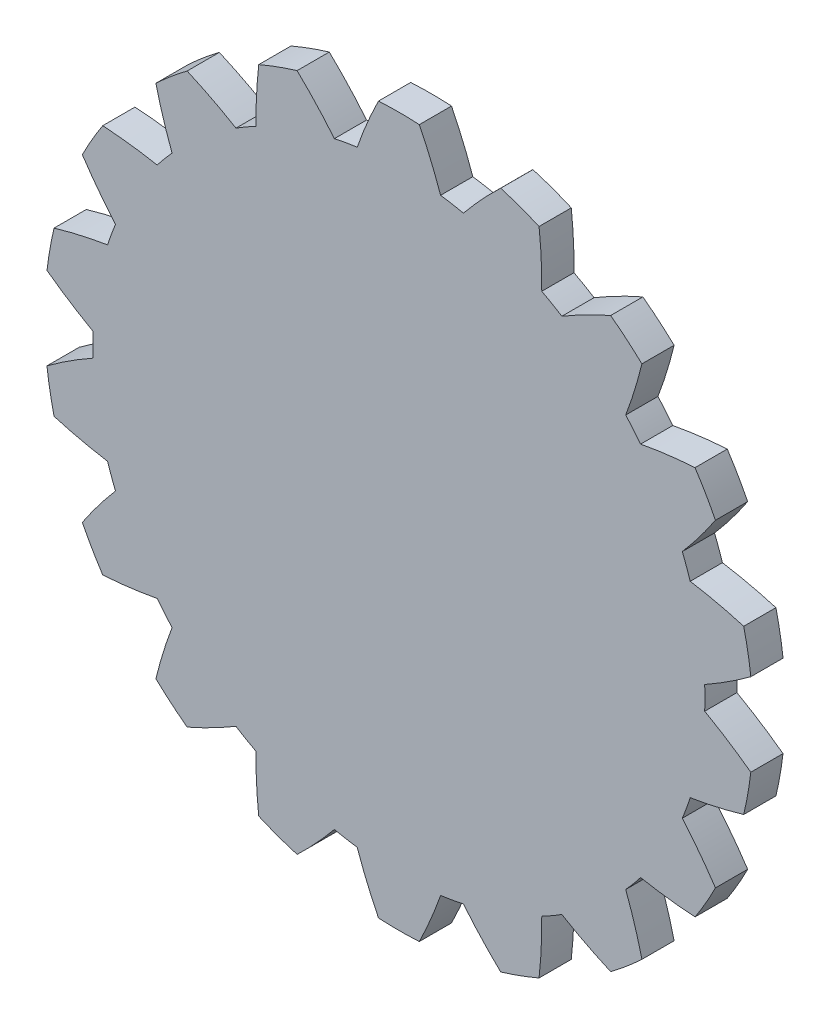
from build123d import *

# Parameters (mm, degrees)
SKETCH1_R           = 55.88
BOSS_EXTRUDE1_DEPTH = 5.08
CUT_EXTRUDE2_START  = -5.08
CUT_EXTRUDE2_DEPTH  = 5.08
CUT_EXTRUDE3_START  = -5.08
CUT_EXTRUDE3_DEPTH  = 5.08
CUT_EXTRUDE4_START  = -5.08
CUT_EXTRUDE4_DEPTH  = 5.08


with BuildPart() as part:
    # Sketch1 → Boss-Extrude1 (new body)
    with BuildSketch(Plane.XY):
        Circle(SKETCH1_R)
    extrude(amount=BOSS_EXTRUDE1_DEPTH)

    # Sketch2 → Cut-Extrude2 (cut)
    with BuildSketch(Plane.XY.offset(5.08).offset(CUT_EXTRUDE2_START)):
        with BuildLine():
            ThreePointArc((6.574796149, 47.810037185), (8.380261054, 47.52682216), (10.173708346, 47.175451863))
            ThreePointArc((10.173708346, 47.175451863), (13.016505162, 50.440575429), (16.055705426, 53.523721127))
            ThreePointArc((16.055705426, 53.523721127), (9.703460168, 55.031057238), (3.21876286, 55.787220451))
            ThreePointArc((3.21876286, 55.787220451), (5.020178988, 51.85054348), (6.574796149, 47.810037185))
        make_face()
    extrude(amount=CUT_EXTRUDE2_DEPTH, mode=Mode.SUBTRACT)

    # Sketch2<8> → Cut-Extrude3 (cut)
    with BuildSketch(Plane.XY.offset(5.08).offset(CUT_EXTRUDE3_START)):
        with BuildLine():
            ThreePointArc((22.530283195, 42.678026421), (24.13, 41.794385987), (25.695113466, 40.850810811))
            ThreePointArc((25.695113466, 40.850810811), (29.483206687, 42.946729558), (33.393618682, 44.804471109))
            ThreePointArc((33.393618682, 44.804471109), (27.94, 48.393499563), (22.105000842, 51.321957657))
            ThreePointArc((22.105000842, 51.321957657), (22.451355463, 47.006570755), (22.530283195, 42.678026421))
        make_face()
        with BuildLine():
            ThreePointArc((35.768285576, 32.39841581), (36.969304825, 31.020930043), (38.117308683, 29.598959082))
            ThreePointArc((38.117308683, 29.598959082), (42.39379836, 30.272874275), (46.703768687, 30.681140631))
            ThreePointArc((46.703768687, 30.681140631), (42.806563481, 35.918971629), (38.325049488, 40.666509338))
            ThreePointArc((38.325049488, 40.666509338), (37.174567122, 36.492911853), (35.768285576, 32.39841581))
        make_face()
        with BuildLine():
            ThreePointArc((44.692104832, 18.211078103), (45.349565879, 16.505892117), (45.941993921, 14.777036053))
            ThreePointArc((45.941993921, 14.777036053), (50.191072284, 13.947663575), (54.380754914, 12.857211789))
            ThreePointArc((54.380754914, 12.857211789), (52.51002365, 19.112085609), (49.922531547, 25.10607982))
            ThreePointArc((49.922531547, 25.10607982), (47.413977348, 21.577669205), (44.692104832, 18.211078103))
        make_face()
        with BuildLine():
            ThreePointArc((48.225396661, 1.827215609), (48.26, 0), (48.225396661, -1.827215609))
            ThreePointArc((48.225396661, -1.827215609), (51.93456215, -4.059841197), (55.498619524, -6.517486548))
            ThreePointArc((55.498619524, -6.517486548), (55.88, 0), (55.498619524, 6.517486548))
            ThreePointArc((55.498619524, 6.517486548), (51.93456215, 4.059841197), (48.225396661, 1.827215609))
        make_face()
        with BuildLine():
            ThreePointArc((45.941993921, -14.777036053), (45.349565879, -16.505892117), (44.692104832, -18.211078103))
            ThreePointArc((44.692104832, -18.211078103), (47.413977348, -21.577669205), (49.922531547, -25.10607982))
            ThreePointArc((49.922531547, -25.10607982), (52.51002365, -19.112085609), (54.380754914, -12.857211789))
            ThreePointArc((54.380754914, -12.857211789), (50.191072284, -13.947663575), (45.941993921, -14.777036053))
        make_face()
        with BuildLine():
            ThreePointArc((38.117308683, -29.598959082), (36.969304825, -31.020930043), (35.768285576, -32.39841581))
            ThreePointArc((35.768285576, -32.39841581), (37.174567122, -36.492911853), (38.325049488, -40.666509338))
            ThreePointArc((38.325049488, -40.666509338), (42.806563481, -35.918971629), (46.703768687, -30.681140631))
            ThreePointArc((46.703768687, -30.681140631), (42.39379836, -30.272874275), (38.117308683, -29.598959082))
        make_face()
        with BuildLine():
            ThreePointArc((25.695113466, -40.850810811), (24.13, -41.794385987), (22.530283195, -42.678026421))
            ThreePointArc((22.530283195, -42.678026421), (22.451355463, -47.006570755), (22.105000842, -51.321957657))
            ThreePointArc((22.105000842, -51.321957657), (27.94, -48.393499563), (33.393618682, -44.804471109))
            ThreePointArc((33.393618682, -44.804471109), (29.483206687, -42.946729558), (25.695113466, -40.850810811))
        make_face()
        with BuildLine():
            ThreePointArc((10.173708346, -47.175451863), (8.380261054, -47.52682216), (6.574796149, -47.810037185))
            ThreePointArc((6.574796149, -47.810037185), (5.020178988, -51.85054348), (3.21876286, -55.787220451))
            ThreePointArc((3.21876286, -55.787220451), (9.703460168, -55.031057238), (16.055705426, -53.523721127))
            ThreePointArc((16.055705426, -53.523721127), (13.016505162, -50.440575429), (10.173708346, -47.175451863))
        make_face()
    extrude(amount=CUT_EXTRUDE3_DEPTH, mode=Mode.SUBTRACT)

    # Sketch2<9> → Cut-Extrude4 (cut)
    with BuildSketch(Plane.XY.offset(5.08).offset(CUT_EXTRUDE4_START)):
        with BuildLine():
            ThreePointArc((-48.225396661, -1.827215609), (-48.26, 0), (-48.225396661, 1.827215609))
            ThreePointArc((-48.225396661, 1.827215609), (-51.93456215, 4.059841197), (-55.498619524, 6.517486548))
            ThreePointArc((-55.498619524, 6.517486548), (-55.88, 0), (-55.498619524, -6.517486548))
            ThreePointArc((-55.498619524, -6.517486548), (-51.93456215, -4.059841197), (-48.225396661, -1.827215609))
        make_face()
        with BuildLine():
            ThreePointArc((-6.574796149, -47.810037185), (-8.380261054, -47.52682216), (-10.173708346, -47.175451863))
            ThreePointArc((-10.173708346, -47.175451863), (-13.016505162, -50.440575429), (-16.055705426, -53.523721127))
            ThreePointArc((-16.055705426, -53.523721127), (-9.703460168, -55.031057238), (-3.21876286, -55.787220451))
            ThreePointArc((-3.21876286, -55.787220451), (-5.020178988, -51.85054348), (-6.574796149, -47.810037185))
        make_face()
        with BuildLine():
            ThreePointArc((-22.530283195, -42.678026421), (-24.13, -41.794385987), (-25.695113466, -40.850810811))
            ThreePointArc((-25.695113466, -40.850810811), (-29.483206687, -42.946729558), (-33.393618682, -44.804471109))
            ThreePointArc((-33.393618682, -44.804471109), (-27.94, -48.393499563), (-22.105000842, -51.321957657))
            ThreePointArc((-22.105000842, -51.321957657), (-22.451355463, -47.006570755), (-22.530283195, -42.678026421))
        make_face()
        with BuildLine():
            ThreePointArc((-35.768285576, -32.39841581), (-36.969304825, -31.020930043), (-38.117308683, -29.598959082))
            ThreePointArc((-38.117308683, -29.598959082), (-42.39379836, -30.272874275), (-46.703768687, -30.681140631))
            ThreePointArc((-46.703768687, -30.681140631), (-42.806563481, -35.918971629), (-38.325049488, -40.666509338))
            ThreePointArc((-38.325049488, -40.666509338), (-37.174567122, -36.492911853), (-35.768285576, -32.39841581))
        make_face()
        with BuildLine():
            ThreePointArc((-44.692104832, -18.211078103), (-45.349565879, -16.505892117), (-45.941993921, -14.777036053))
            ThreePointArc((-45.941993921, -14.777036053), (-50.191072284, -13.947663575), (-54.380754914, -12.857211789))
            ThreePointArc((-54.380754914, -12.857211789), (-52.51002365, -19.112085609), (-49.922531547, -25.10607982))
            ThreePointArc((-49.922531547, -25.10607982), (-47.413977348, -21.577669205), (-44.692104832, -18.211078103))
        make_face()
        with BuildLine():
            ThreePointArc((-45.941993921, 14.777036053), (-45.349565879, 16.505892117), (-44.692104832, 18.211078103))
            ThreePointArc((-44.692104832, 18.211078103), (-47.413977348, 21.577669205), (-49.922531547, 25.10607982))
            ThreePointArc((-49.922531547, 25.10607982), (-52.51002365, 19.112085609), (-54.380754914, 12.857211789))
            ThreePointArc((-54.380754914, 12.857211789), (-50.191072284, 13.947663575), (-45.941993921, 14.777036053))
        make_face()
        with BuildLine():
            ThreePointArc((-38.117308683, 29.598959082), (-36.969304825, 31.020930043), (-35.768285576, 32.39841581))
            ThreePointArc((-35.768285576, 32.39841581), (-37.174567122, 36.492911853), (-38.325049488, 40.666509338))
            ThreePointArc((-38.325049488, 40.666509338), (-42.806563481, 35.918971629), (-46.703768687, 30.681140631))
            ThreePointArc((-46.703768687, 30.681140631), (-42.39379836, 30.272874275), (-38.117308683, 29.598959082))
        make_face()
        with BuildLine():
            ThreePointArc((-25.695113466, 40.850810811), (-24.13, 41.794385987), (-22.530283195, 42.678026421))
            ThreePointArc((-22.530283195, 42.678026421), (-22.451355463, 47.006570755), (-22.105000842, 51.321957657))
            ThreePointArc((-22.105000842, 51.321957657), (-27.94, 48.393499563), (-33.393618682, 44.804471109))
            ThreePointArc((-33.393618682, 44.804471109), (-29.483206687, 42.946729558), (-25.695113466, 40.850810811))
        make_face()
        with BuildLine():
            ThreePointArc((-10.173708346, 47.175451863), (-8.380261054, 47.52682216), (-6.574796149, 47.810037185))
            ThreePointArc((-6.574796149, 47.810037185), (-5.020178988, 51.85054348), (-3.21876286, 55.787220451))
            ThreePointArc((-3.21876286, 55.787220451), (-9.703460168, 55.031057238), (-16.055705426, 53.523721127))
            ThreePointArc((-16.055705426, 53.523721127), (-13.016505162, 50.440575429), (-10.173708346, 47.175451863))
        make_face()
    extrude(amount=CUT_EXTRUDE4_DEPTH, mode=Mode.SUBTRACT)


solid = part.part
